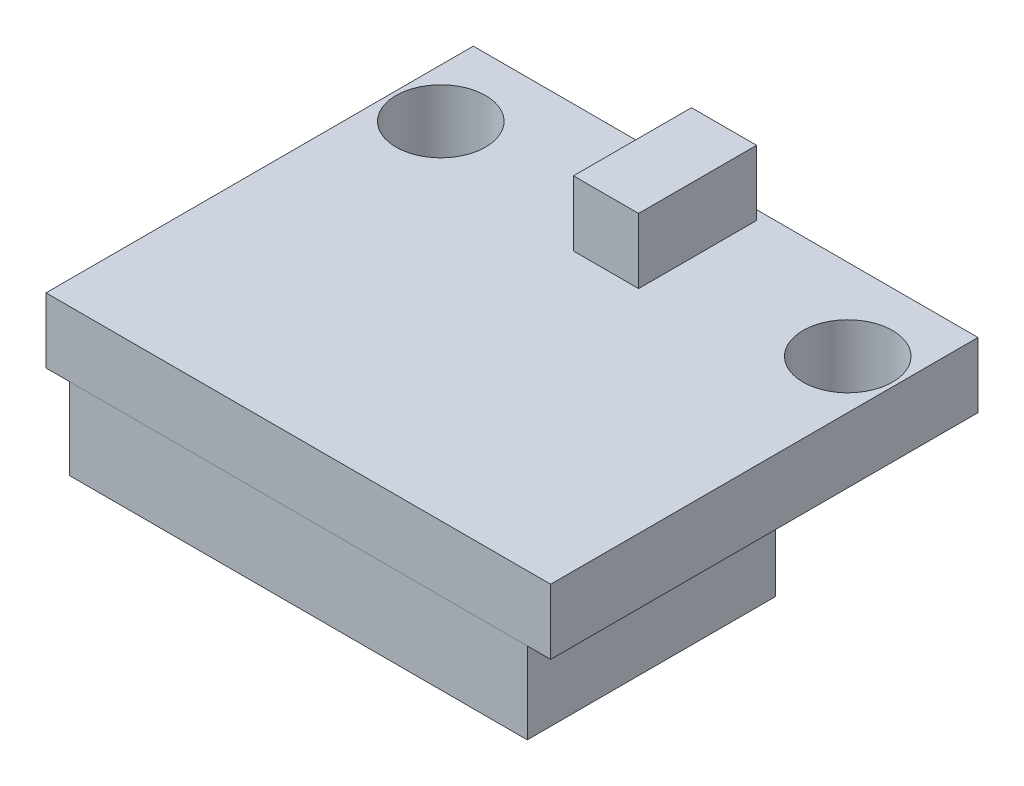
from build123d import *

# Parameters (mm, degrees)
SKETCH1_W           = 12.4
SKETCH1_H           = 10.5
BOSS_EXTRUDE1_DEPTH = 1.6
SKETCH2_R           = 1.1
CUT_EXTRUDE1_DEPTH  = 12.008383169
SKETCH3_W           = 1.6
SKETCH3_H           = 2.9
BOSS_EXTRUDE2_DEPTH = 1.6
SKETCH4_W           = 11.25
SKETCH4_H           = 6.1
BOSS_EXTRUDE3_DEPTH = 2


with BuildPart() as part:
    # Sketch1 → Boss-Extrude1 (new body)
    with BuildSketch(Plane(origin=(0, 0, 0), x_dir=(1, 0, 0), z_dir=(0, 1, 0))):
        with Locations((-0.19, -3.57)):
            Rectangle(SKETCH1_W, SKETCH1_H)
    extrude(amount=BOSS_EXTRUDE1_DEPTH)

    # Sketch2 → Cut-Extrude1 (cut, through all)
    with BuildSketch(Plane(origin=(0, 0, 0), x_dir=(1, 0, 0), z_dir=(0, 1, 0))):
        with Locations((4.81, -0.32)):
            Circle(SKETCH2_R)
        with Locations((-5.19, -0.32)):
            Circle(SKETCH2_R)
    extrude(amount=CUT_EXTRUDE1_DEPTH, mode=Mode.SUBTRACT)


with BuildPart() as body_2:
    # Sketch3 → Boss-Extrude2 (new body)
    with BuildSketch(Plane(origin=(0, 1.6, 0), x_dir=(1, 0, 0), z_dir=(0, 1, 0))):
        Rectangle(SKETCH3_W, SKETCH3_H)
    extrude(amount=BOSS_EXTRUDE2_DEPTH)


with BuildPart() as body_3:
    # Sketch4 → Boss-Extrude3 (new body)
    with BuildSketch(Plane.XZ):
        with Locations((-0.19, 5.77)):
            Rectangle(SKETCH4_W, SKETCH4_H)
    extrude(amount=BOSS_EXTRUDE3_DEPTH)


solid = Compound([part.part, body_2.part, body_3.part])
